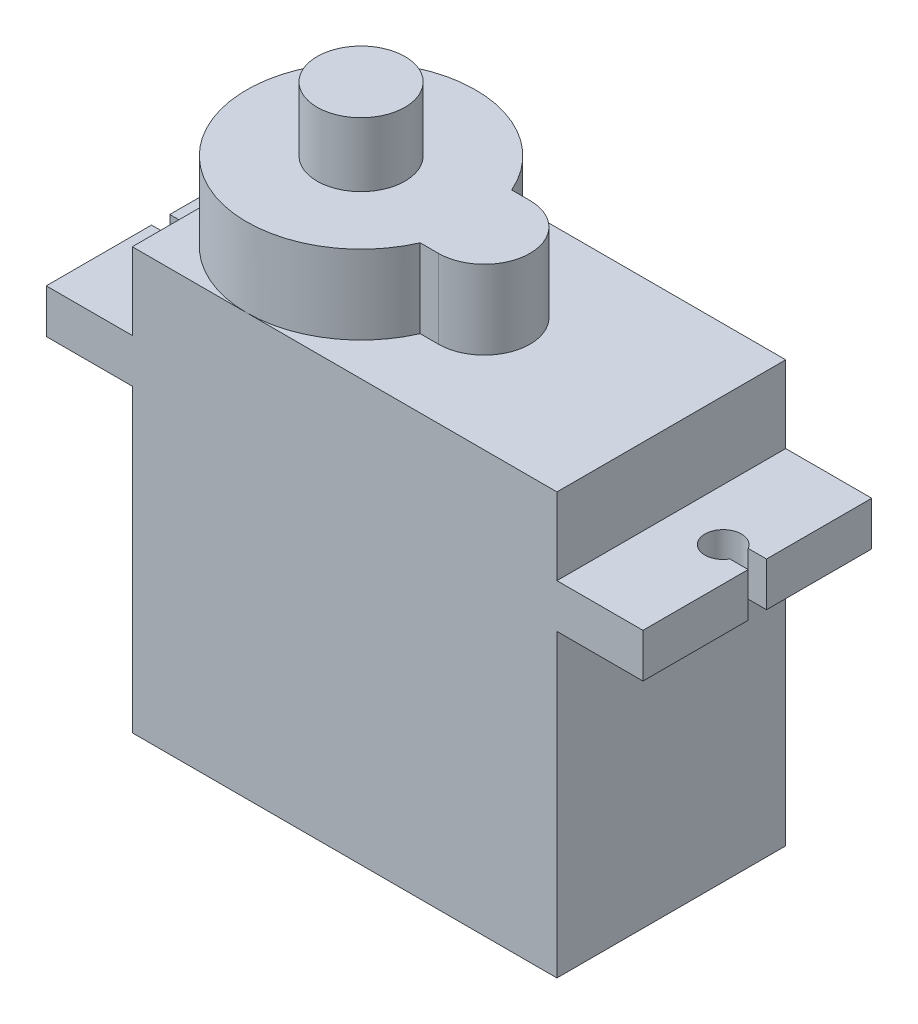
from build123d import *

# Parameters (mm, degrees)
BOSS_EXTRUDE1_DEPTH = 12.5
BOSS_EXTRUDE2_DEPTH = 4.3
SKETCH4_R           = 2.4
BOSS_EXTRUDE3_DEPTH = 3.5
CUT_EXTRUDE1_REACH  = 37.89


with BuildPart() as part:
    # Sketch1 → Boss-Extrude1 (new body)
    with BuildSketch(Plane.XY):
        Polygon((0, 0), (23.2, 0), (23.2, 16.4), (27.9, 16.4), (27.9, 18.8), (23.2, 18.8), (23.2, 23), (0, 23), (0, 18.8), (-4.7, 18.8), (-4.7, 16.4), (0, 16.4), align=None)
    extrude(amount=BOSS_EXTRUDE1_DEPTH)

    # Sketch3 → Boss-Extrude2 (add)
    with BuildSketch(Plane(origin=(0, 23, 0), x_dir=(1, 0, 0), z_dir=(0, 1, 0))):
        with BuildLine():
            Line((11.978219619, -8.75), (12.978219619, -8.75))
            ThreePointArc((12.978219619, -8.75), (15.478219619, -6.25), (12.978219619, -3.75))
            Line((12.978219619, -3.75), (11.978219619, -3.75))
            ThreePointArc((11.978219619, -3.75), (0, -6.25), (11.978219619, -8.75))
        make_face()
    extrude(amount=BOSS_EXTRUDE2_DEPTH)

    # Sketch4 → Boss-Extrude3 (add)
    with BuildSketch(Plane(origin=(0, 27.3, 0), x_dir=(1, 0, 0), z_dir=(0, 1, 0))):
        with Locations(Location((6.25, -6.25, 0), (0, 0, 270))):
            Circle(SKETCH4_R)
    extrude(amount=BOSS_EXTRUDE3_DEPTH)

    # Sketch2 → Cut-Extrude1 (cut, up to next)
    with BuildSketch(Plane(origin=(0, 18.8, 0), x_dir=(1, 0, 0), z_dir=(0, 1, 0)), mode=Mode.PRIVATE) as cut_extrude1_sk1:
        with BuildLine():
            Line((27.9, -6.75), (27.9, -5.75))
            Line((27.9, -5.75), (26.9, -5.75))
            ThreePointArc((26.9, -5.75), (25.033974596, -6.25), (26.9, -6.75))
            Line((26.9, -6.75), (27.9, -6.75))
        make_face()
    cut_extrude1_tool1 = extrude(cut_extrude1_sk1.sketch, amount=-CUT_EXTRUDE1_REACH, mode=Mode.PRIVATE) & part.part
    # Sketch2 → Cut-Extrude1 (cut, up to next)
    with BuildSketch(Plane(origin=(0, 18.8, 0), x_dir=(1, 0, 0), z_dir=(0, 1, 0)), mode=Mode.PRIVATE) as cut_extrude1_sk2:
        with BuildLine():
            Line((-4.7, -6.75), (-3.7, -6.75))
            ThreePointArc((-3.7, -6.75), (-1.833974596, -6.25), (-3.7, -5.75))
            Line((-3.7, -5.75), (-4.7, -5.75))
            Line((-4.7, -5.75), (-4.7, -6.75))
        make_face()
    cut_extrude1_tool2 = extrude(cut_extrude1_sk2.sketch, amount=-CUT_EXTRUDE1_REACH, mode=Mode.PRIVATE) & part.part
    add(cut_extrude1_tool1.solids().sort_by_distance((26.35061, 18.8, 6.25))[0], mode=Mode.SUBTRACT)
    add(cut_extrude1_tool2.solids().sort_by_distance((-3.15061, 18.8, 6.25))[0], mode=Mode.SUBTRACT)


solid = part.part
